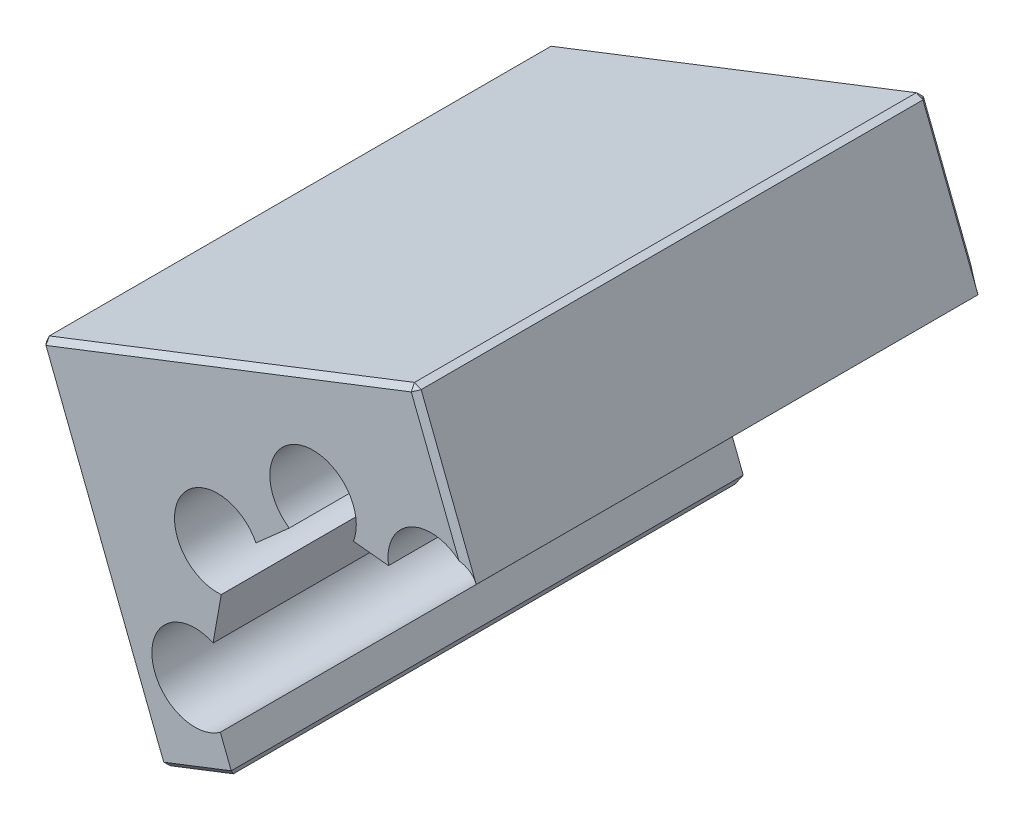
from build123d import *

# Parameters (mm, degrees)
EXTRUDE_2_DEPTH = 250
CHAMFER_1_SIZE  = 2.5


with BuildPart() as part:
    # 草圖1 → 填料-伸長2 (new body)
    with BuildSketch(Plane(origin=(1e-09, -1e-09, 12827.735128457), x_dir=(1, 0, 0), z_dir=(0, 0, 1))):
        with BuildLine():
            Line((-112.117770632, -75.640230505), (-108.139732902, -53.167558993))
            ThreePointArc((-108.139732902, -53.167558993), (-128.285417164, -21.997695969), (-91.181469021, -22.837926636))
            Line((-91.181469021, -22.837926636), (-74.915186503, -8.426224475))
            ThreePointArc((-74.915186503, -8.426224475), (-69.768626313, 29.297285814), (-43.57987489, 1.662170304))
            Line((-43.57987489, 1.662170304), (-26.446012397, -0.086903016))
            ThreePointArc((-26.446012397, -0.086903016), (-11.209248537, 23.49241234), (13.857582965, 10.851326786))
            Line((13.857582965, 10.851326786), (-13.929514572, 82.148324057))
            Line((-13.929514572, 82.148324057), (-196.933065463, 10.825018546))
            Line((-196.933065463, 10.825018546), (-137.638404215, -141.315063571))
            Line((-137.638404215, -141.315063571), (-102.351415407, -127.562408658))
            Line((-102.351415407, -127.562408658), (-108.57535624, -111.5928281))
            ThreePointArc((-108.57535624, -111.5928281), (-141.904281803, -96.725915639), (-112.117770632, -75.640230505))
        make_face()
    extrude(amount=-EXTRUDE_2_DEPTH)

    # 導角1
    chamfer_1_edges = [part.edges().sort_by_distance(p)[0] for p in [
        (-119.99490981, -134.438736116, 12827.735128457),
        (-167.285734839, -65.245022514, 12827.735128457),
        (-105.431290017, 46.4866713, 12827.735128457),
        (-0.035965803, 46.49982542, 12827.735128457),
        (-0.035965803, 46.49982542, 12577.735128457),
        (-102.351415406, -127.562408659, 12702.735128457),
        (-137.638404215, -141.315063573, 12702.735128457),
        (-196.933065463, 10.825018545, 12702.735128457),
        (-13.929514572, 82.148324055, 12702.735128457),
        (-105.431290017, 46.4866713, 12577.735128457),
        (-167.285734839, -65.245022514, 12577.735128457),
        (-119.99490981, -134.438736116, 12577.735128457),
    ]]
    chamfer(chamfer_1_edges, length=CHAMFER_1_SIZE)


solid = part.part
